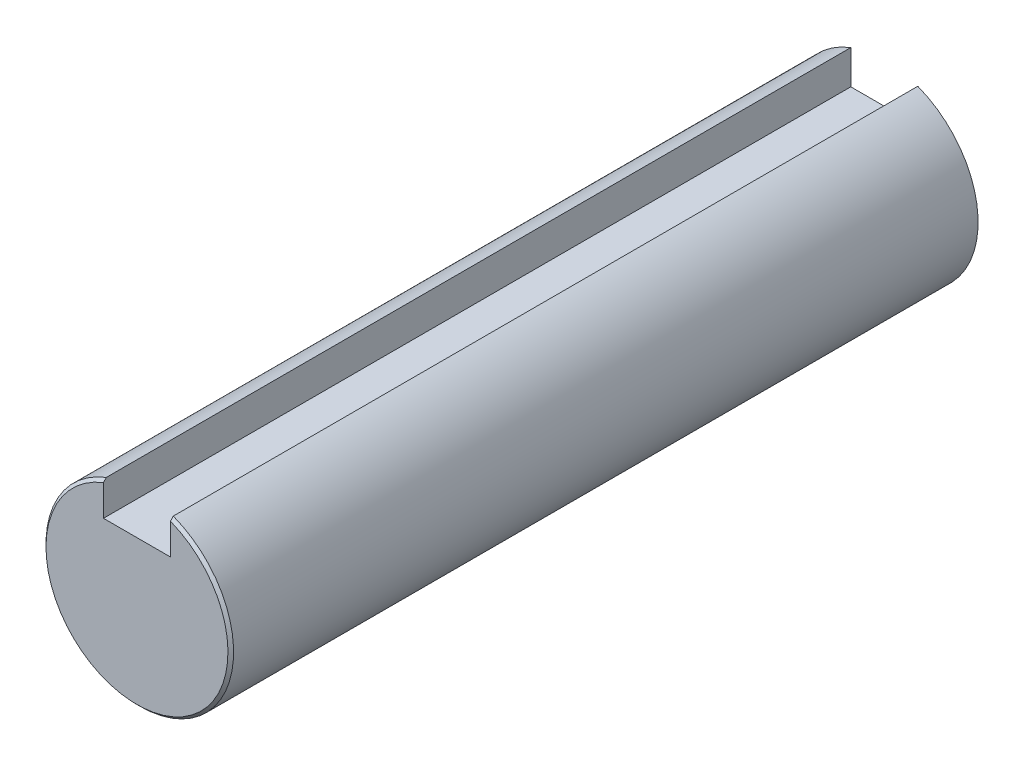
from build123d import *

# Parameters (mm, degrees)
BOSS_EXTRUDE1_DEPTH      = 100
BOSS_EXTRUDE1_DEPTH_BACK = 100
CHAMFER1_SIZE            = 0.21
CUT_EXTRUDE1_DEPTH       = 101.488805347
CUT_EXTRUDE1_DEPTH_BACK  = 101.488805347
SKETCH4_W                = 104.931235955
SKETCH4_H                = 144.2275


with BuildPart() as part:
    # Sketch3 → Boss-Extrude1 (new, two sides: drawn at the far end of the back side and taken through both)
    with BuildSketch(Plane.XY.offset(-BOSS_EXTRUDE1_DEPTH_BACK)):
        with BuildLine():
            Line((-2.5, 4), (-2.5, 6.538348415))
            ThreePointArc((-2.5, 6.538348415), (0, -7), (2.5, 6.538348415))
            Line((2.5, 6.538348415), (2.5, 4))
            Line((2.5, 4), (-2.5, 4))
        make_face()
    extrude(amount=BOSS_EXTRUDE1_DEPTH + BOSS_EXTRUDE1_DEPTH_BACK)

    # Chamfer1
    chamfer1_edges = [part.edges().sort_by_distance(p)[0] for p in [
        (0, -7, -100),
        (0, -7, 100),
    ]]
    chamfer(chamfer1_edges, length=CHAMFER1_SIZE)

    # Sketch4 → Cut-Extrude1 (cut, two sides: drawn at the far end of the back side and taken through both)
    with BuildSketch(Plane(origin=(0, 0, 0), x_dir=(1, 0, 0), z_dir=(0, 1, 0)).offset(-CUT_EXTRUDE1_DEPTH_BACK)):
        with Locations((22.551011235, 27.88625)):
            Rectangle(SKETCH4_W, SKETCH4_H)
    extrude(amount=CUT_EXTRUDE1_DEPTH + CUT_EXTRUDE1_DEPTH_BACK, mode=Mode.SUBTRACT)


solid = part.part
